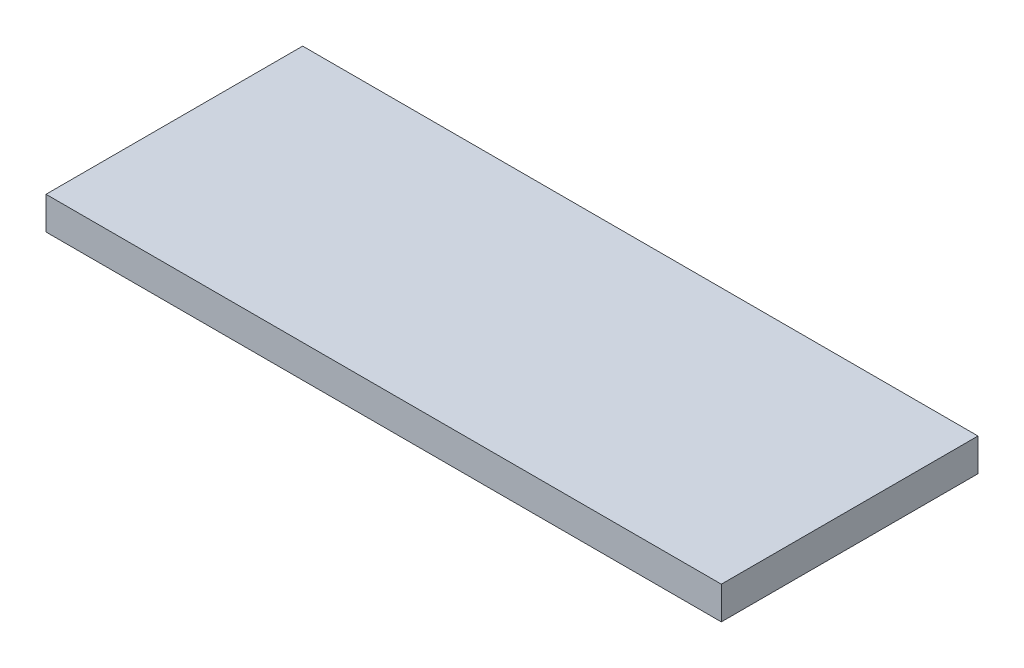
from build123d import *

# Parameters (mm, degrees)
SKETCH1_W           = 17.5768
SKETCH1_H           = 6.6802
BOSS_EXTRUDE1_DEPTH = 0.8509


with BuildPart() as part:
    # Sketch1 → Boss-Extrude1 (new body)
    with BuildSketch(Plane(origin=(0, 0, 0), x_dir=(1, 0, 0), z_dir=(0, 1, 0))):
        with Locations((8.7884, 3.3401)):
            Rectangle(SKETCH1_W, SKETCH1_H)
    extrude(amount=BOSS_EXTRUDE1_DEPTH)


solid = part.part
